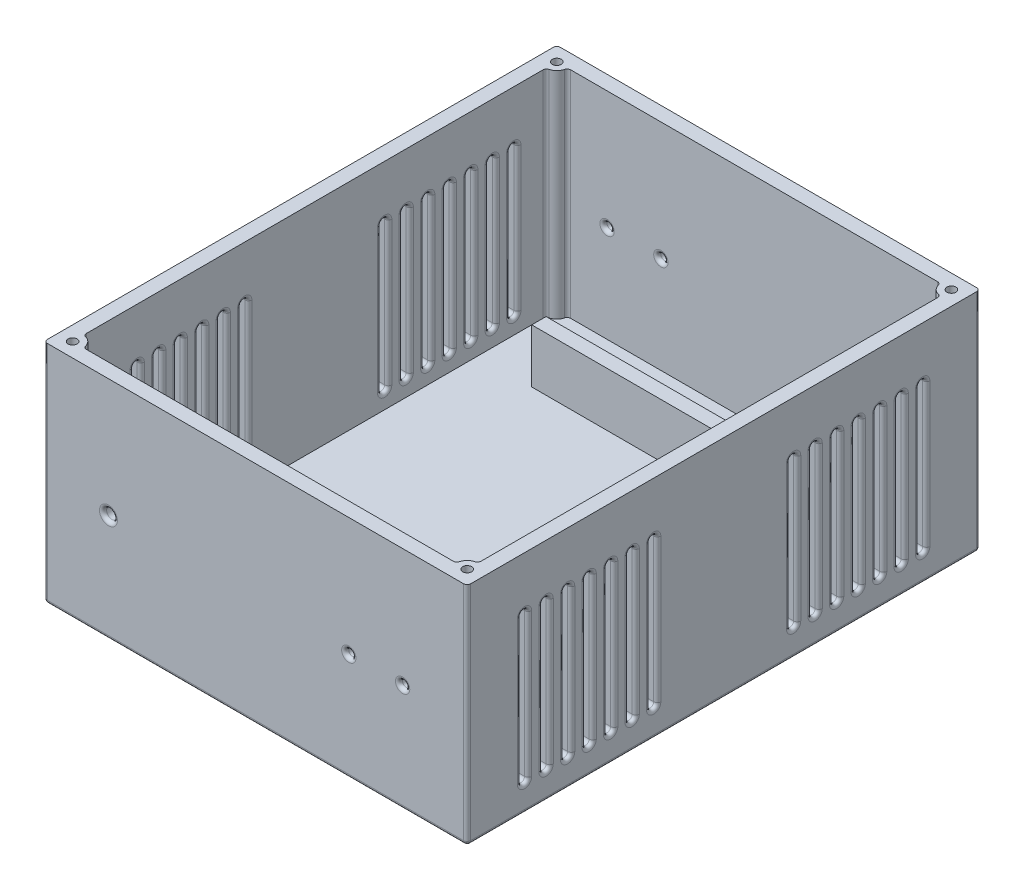
from build123d import *

# Parameters (mm, degrees)
SKETCH20_W           = 110
SKETCH20_H           = 135
BOSS_EXTRUDE7_DEPTH  = 3
SKETCH20_4_W         = 118
SKETCH20_4_H         = 143
SKETCH20_4_W_2       = 110
SKETCH20_4_H_2       = 135
BOSS_EXTRUDE8_DEPTH  = 63
BOSS_EXTRUDE9_DEPTH  = 60
SKETCH22_R           = 1.25
CUT_EXTRUDE9_DEPTH   = 40
FILLET1_R            = 1
SKETCH27_R           = 1
CUT_EXTRUDE7_DEPTH   = 4
CUT_EXTRUDE8_START   = -4
SKETCH28_R           = 1.5
SKETCH28_R_2         = 1
CUT_EXTRUDE8_DEPTH   = 4
SKETCH29_W           = 80
SKETCH29_H           = 4
BOSS_EXTRUDE11_DEPTH = 15
FILLET3_R            = 1
CUT_EXTRUDE10_DEPTH  = 4
CUT_EXTRUDE11_START  = -4
CUT_EXTRUDE11_DEPTH  = 4
FILLET5_R            = 1


with BuildPart() as part:
    # Sketch20 → Boss-Extrude7 (new body)
    with BuildSketch(Plane(origin=(0, 0, 0), x_dir=(1, 0, 0), z_dir=(0, 1, 0))):
        Rectangle(SKETCH20_W, SKETCH20_H)
    extrude(amount=BOSS_EXTRUDE7_DEPTH)

    # Sketch20<4> → Boss-Extrude8 (add)
    with BuildSketch(Plane(origin=(0, 0, 0), x_dir=(1, 0, 0), z_dir=(0, 1, 0))):
        Rectangle(SKETCH20_4_W, SKETCH20_4_H)
        Rectangle(SKETCH20_4_W_2, SKETCH20_4_H_2, mode=Mode.SUBTRACT)
    extrude(amount=BOSS_EXTRUDE8_DEPTH)

    # Sketch21 → Boss-Extrude9 (add)
    with BuildSketch(Plane(origin=(0, 3, 0), x_dir=(1, 0, 0), z_dir=(0, 1, 0))):
        with BuildLine():
            Line((-55, -67.5), (-55, -64.5))
            ThreePointArc((-55, -64.5), (-52.878679656, -65.378679656), (-52, -67.5))
            Line((-52, -67.5), (-55, -67.5))
        make_face()
        with BuildLine():
            Line((-55, 67.5), (-52, 67.5))
            ThreePointArc((-52, 67.5), (-52.878679656, 65.378679656), (-55, 64.5))
            Line((-55, 64.5), (-55, 67.5))
        make_face()
        with BuildLine():
            Line((55, -67.5), (52, -67.5))
            ThreePointArc((52, -67.5), (52.878679656, -65.378679656), (55, -64.5))
            Line((55, -64.5), (55, -67.5))
        make_face()
        with BuildLine():
            Line((55, 67.5), (55, 64.5))
            ThreePointArc((55, 64.5), (52.878679656, 65.378679656), (52, 67.5))
            Line((52, 67.5), (55, 67.5))
        make_face()
    extrude(amount=BOSS_EXTRUDE9_DEPTH)

    # Sketch22 → Cut-Extrude9 (cut)
    with BuildSketch(Plane(origin=(0, 63, 0), x_dir=(1, 0, 0), z_dir=(0, 1, 0))):
        with Locations((-55, -67.5)):
            Circle(SKETCH22_R)
        with Locations((-55, 67.5)):
            Circle(SKETCH22_R)
        with Locations((55, 67.5)):
            Circle(SKETCH22_R)
        with Locations((55, -67.5)):
            Circle(SKETCH22_R)
    extrude(amount=-CUT_EXTRUDE9_DEPTH, mode=Mode.SUBTRACT)

    # Fillet1
    fillet1_edges = [part.edges().sort_by_distance(p)[0] for p in [
        (-52, 33, -67.5),
        (-55, 33, -64.5),
        (-55, 33, 64.5),
        (52, 33, 67.5),
        (55, 33, 64.5),
        (55, 33, -64.5),
        (52, 33, -67.5),
        (-52, 33, 67.5),
    ]]
    fillet(fillet1_edges, radius=FILLET1_R)

    # Sketch27 → Cut-Extrude7 (cut)
    with BuildSketch(Plane(origin=(0, 0, -71.5), x_dir=(-1, 0, 0), z_dir=(0, 0, -1))):
        with Locations((-41, 30)):
            Circle(SKETCH27_R)
        with Locations((-26, 30)):
            Circle(SKETCH27_R)
        with Locations((41, 30)):
            Circle(SKETCH27_R)
        with Locations((26, 30)):
            Circle(SKETCH27_R)
    extrude(amount=-CUT_EXTRUDE7_DEPTH, mode=Mode.SUBTRACT)

    # Sketch28 → Cut-Extrude8 (cut)
    with BuildSketch(Plane.XY.offset(71.5).offset(CUT_EXTRUDE8_START)):
        with Locations((-41, 30)):
            Circle(SKETCH28_R)
        with Locations((41, 30)):
            Circle(SKETCH28_R_2)
        with Locations((26, 30)):
            Circle(SKETCH28_R_2)
    extrude(amount=CUT_EXTRUDE8_DEPTH, mode=Mode.SUBTRACT)

    # Sketch29 → Boss-Extrude11 (add)
    with BuildSketch(Plane(origin=(0, 3, 0), x_dir=(1, 0, 0), z_dir=(0, 1, 0))):
        with Locations((0, 47.5)):
            Rectangle(SKETCH29_W, SKETCH29_H)
        with Locations((0, -47.5)):
            Rectangle(SKETCH29_W, SKETCH29_H)
    extrude(amount=BOSS_EXTRUDE11_DEPTH)

    # Fillet3
    fillet3_edges = [part.edges().sort_by_distance(p)[0] for p in [
        (25, 30, 71.5),
        (40, 30, 71.5),
        (-42.5, 30, 71.5),
        (25, 30, 67.5),
        (40, 30, 67.5),
        (-42.5, 30, 67.5),
        (-40, 30, -67.5),
        (-25, 30, -67.5),
        (42, 30, -67.5),
        (27, 30, -67.5),
        (27, 30, -71.5),
        (-40, 30, -71.5),
        (-25, 30, -71.5),
        (42, 30, -71.5),
    ]]
    fillet(fillet3_edges, radius=FILLET3_R)

    # Sketch31 → Cut-Extrude10 (cut)
    with BuildSketch(Plane(origin=(59, 0, 0), x_dir=(0, 0, -1), z_dir=(1, 0, 0))):
        with BuildLine():
            Line((-54.5, 48), (-54.5, 8))
            ThreePointArc((-54.5, 8), (-55.5, 7), (-56.5, 8))
            Line((-56.5, 8), (-56.5, 48))
            ThreePointArc((-56.5, 48), (-55.5, 49), (-54.5, 48))
        make_face()
        with BuildLine():
            Line((-48.5, 48), (-48.5, 8))
            ThreePointArc((-48.5, 8), (-49.5, 7), (-50.5, 8))
            Line((-50.5, 8), (-50.5, 48))
            ThreePointArc((-50.5, 48), (-49.5, 49), (-48.5, 48))
        make_face()
        with BuildLine():
            Line((-42.5, 48), (-42.5, 8))
            ThreePointArc((-42.5, 8), (-43.5, 7), (-44.5, 8))
            Line((-44.5, 8), (-44.5, 48))
            ThreePointArc((-44.5, 48), (-43.5, 49), (-42.5, 48))
        make_face()
        with BuildLine():
            Line((-36.5, 48), (-36.5, 8))
            ThreePointArc((-36.5, 8), (-37.5, 7), (-38.5, 8))
            Line((-38.5, 8), (-38.5, 48))
            ThreePointArc((-38.5, 48), (-37.5, 49), (-36.5, 48))
        make_face()
        with BuildLine():
            Line((-30.5, 48), (-30.5, 8))
            ThreePointArc((-30.5, 8), (-31.5, 7), (-32.5, 8))
            Line((-32.5, 8), (-32.5, 48))
            ThreePointArc((-32.5, 48), (-31.5, 49), (-30.5, 48))
        make_face()
        with BuildLine():
            Line((-24.5, 48), (-24.5, 8))
            ThreePointArc((-24.5, 8), (-25.5, 7), (-26.5, 8))
            Line((-26.5, 8), (-26.5, 48))
            ThreePointArc((-26.5, 48), (-25.5, 49), (-24.5, 48))
        make_face()
        with BuildLine():
            Line((-18.5, 48), (-18.5, 8))
            ThreePointArc((-18.5, 8), (-19.5, 7), (-20.5, 8))
            Line((-20.5, 8), (-20.5, 48))
            ThreePointArc((-20.5, 48), (-19.5, 49), (-18.5, 48))
        make_face()
        with BuildLine():
            Line((18.5, 48), (18.5, 8))
            ThreePointArc((18.5, 8), (19.5, 7), (20.5, 8))
            Line((20.5, 8), (20.5, 48))
            ThreePointArc((20.5, 48), (19.5, 49), (18.5, 48))
        make_face()
        with BuildLine():
            Line((24.5, 48), (24.5, 8))
            ThreePointArc((24.5, 8), (25.5, 7), (26.5, 8))
            Line((26.5, 8), (26.5, 48))
            ThreePointArc((26.5, 48), (25.5, 49), (24.5, 48))
        make_face()
        with BuildLine():
            Line((30.5, 48), (30.5, 8))
            ThreePointArc((30.5, 8), (31.5, 7), (32.5, 8))
            Line((32.5, 8), (32.5, 48))
            ThreePointArc((32.5, 48), (31.5, 49), (30.5, 48))
        make_face()
        with BuildLine():
            Line((36.5, 48), (36.5, 8))
            ThreePointArc((36.5, 8), (37.5, 7), (38.5, 8))
            Line((38.5, 8), (38.5, 48))
            ThreePointArc((38.5, 48), (37.5, 49), (36.5, 48))
        make_face()
        with BuildLine():
            Line((42.5, 48), (42.5, 8))
            ThreePointArc((42.5, 8), (43.5, 7), (44.5, 8))
            Line((44.5, 8), (44.5, 48))
            ThreePointArc((44.5, 48), (43.5, 49), (42.5, 48))
        make_face()
        with BuildLine():
            Line((48.5, 48), (48.5, 8))
            ThreePointArc((48.5, 8), (49.5, 7), (50.5, 8))
            Line((50.5, 8), (50.5, 48))
            ThreePointArc((50.5, 48), (49.5, 49), (48.5, 48))
        make_face()
        with BuildLine():
            Line((54.5, 48), (54.5, 8))
            ThreePointArc((54.5, 8), (55.5, 7), (56.5, 8))
            Line((56.5, 8), (56.5, 48))
            ThreePointArc((56.5, 48), (55.5, 49), (54.5, 48))
        make_face()
    extrude(amount=-CUT_EXTRUDE10_DEPTH, mode=Mode.SUBTRACT)

    # Sketch32 → Cut-Extrude11 (cut)
    with BuildSketch(Plane.ZY.offset(59).offset(CUT_EXTRUDE11_START)):
        with BuildLine():
            Line((-54.5, 48), (-54.5, 8))
            ThreePointArc((-54.5, 8), (-55.5, 7), (-56.5, 8))
            Line((-56.5, 8), (-56.5, 48))
            ThreePointArc((-56.5, 48), (-55.5, 49), (-54.5, 48))
        make_face()
        with BuildLine():
            Line((-48.5, 48), (-48.5, 8))
            ThreePointArc((-48.5, 8), (-49.5, 7), (-50.5, 8))
            Line((-50.5, 8), (-50.5, 48))
            ThreePointArc((-50.5, 48), (-49.5, 49), (-48.5, 48))
        make_face()
        with BuildLine():
            Line((-42.5, 48), (-42.5, 8))
            ThreePointArc((-42.5, 8), (-43.5, 7), (-44.5, 8))
            Line((-44.5, 8), (-44.5, 48))
            ThreePointArc((-44.5, 48), (-43.5, 49), (-42.5, 48))
        make_face()
        with BuildLine():
            Line((-36.5, 48), (-36.5, 8))
            ThreePointArc((-36.5, 8), (-37.5, 7), (-38.5, 8))
            Line((-38.5, 8), (-38.5, 48))
            ThreePointArc((-38.5, 48), (-37.5, 49), (-36.5, 48))
        make_face()
        with BuildLine():
            Line((-30.5, 48), (-30.5, 8))
            ThreePointArc((-30.5, 8), (-31.5, 7), (-32.5, 8))
            Line((-32.5, 8), (-32.5, 48))
            ThreePointArc((-32.5, 48), (-31.5, 49), (-30.5, 48))
        make_face()
        with BuildLine():
            Line((-24.5, 48), (-24.5, 8))
            ThreePointArc((-24.5, 8), (-25.5, 7), (-26.5, 8))
            Line((-26.5, 8), (-26.5, 48))
            ThreePointArc((-26.5, 48), (-25.5, 49), (-24.5, 48))
        make_face()
        with BuildLine():
            Line((-18.5, 48), (-18.5, 8))
            ThreePointArc((-18.5, 8), (-19.5, 7), (-20.5, 8))
            Line((-20.5, 8), (-20.5, 48))
            ThreePointArc((-20.5, 48), (-19.5, 49), (-18.5, 48))
        make_face()
        with BuildLine():
            Line((18.5, 48), (18.5, 8))
            ThreePointArc((18.5, 8), (19.5, 7), (20.5, 8))
            Line((20.5, 8), (20.5, 48))
            ThreePointArc((20.5, 48), (19.5, 49), (18.5, 48))
        make_face()
        with BuildLine():
            Line((24.5, 48), (24.5, 8))
            ThreePointArc((24.5, 8), (25.5, 7), (26.5, 8))
            Line((26.5, 8), (26.5, 48))
            ThreePointArc((26.5, 48), (25.5, 49), (24.5, 48))
        make_face()
        with BuildLine():
            Line((30.5, 48), (30.5, 8))
            ThreePointArc((30.5, 8), (31.5, 7), (32.5, 8))
            Line((32.5, 8), (32.5, 48))
            ThreePointArc((32.5, 48), (31.5, 49), (30.5, 48))
        make_face()
        with BuildLine():
            Line((36.5, 48), (36.5, 8))
            ThreePointArc((36.5, 8), (37.5, 7), (38.5, 8))
            Line((38.5, 8), (38.5, 48))
            ThreePointArc((38.5, 48), (37.5, 49), (36.5, 48))
        make_face()
        with BuildLine():
            Line((42.5, 48), (42.5, 8))
            ThreePointArc((42.5, 8), (43.5, 7), (44.5, 8))
            Line((44.5, 8), (44.5, 48))
            ThreePointArc((44.5, 48), (43.5, 49), (42.5, 48))
        make_face()
        with BuildLine():
            Line((48.5, 48), (48.5, 8))
            ThreePointArc((48.5, 8), (49.5, 7), (50.5, 8))
            Line((50.5, 8), (50.5, 48))
            ThreePointArc((50.5, 48), (49.5, 49), (48.5, 48))
        make_face()
        with BuildLine():
            Line((54.5, 48), (54.5, 8))
            ThreePointArc((54.5, 8), (55.5, 7), (56.5, 8))
            Line((56.5, 8), (56.5, 48))
            ThreePointArc((56.5, 48), (55.5, 49), (54.5, 48))
        make_face()
    extrude(amount=CUT_EXTRUDE11_DEPTH, mode=Mode.SUBTRACT)

    # Fillet5
    fillet5_edges = [part.edges().sort_by_distance(p)[0] for p in [
        (-59, 0, 0),
        (-59, 31.5, -71.5),
        (0, 0, -71.5),
        (59, 31.5, -71.5),
        (59, 0, 0),
        (59, 31.5, 71.5),
        (-59, 31.5, 71.5),
        (0, 0, 71.5),
        (-55, 28, 56.5),
        (-55, 7, 55.5),
        (-55, 28, 54.5),
        (-55, 49, 55.5),
        (-55, 28, 50.5),
        (-55, 7, 49.5),
        (-55, 28, 48.5),
        (-55, 49, 49.5),
        (-55, 28, 44.5),
        (-55, 7, 43.5),
        (-55, 28, 42.5),
        (-55, 49, 43.5),
        (-55, 28, 38.5),
        (-55, 7, 37.5),
        (-55, 28, 36.5),
        (-55, 49, 37.5),
        (-55, 28, 32.5),
        (-55, 7, 31.5),
        (-55, 28, 30.5),
        (-55, 49, 31.5),
        (-55, 28, 26.5),
        (-55, 7, 25.5),
        (-55, 28, 24.5),
        (-55, 49, 25.5),
        (-55, 28, 20.5),
        (-55, 7, 19.5),
        (-55, 49, 19.5),
        (-55, 28, -18.5),
        (-55, 7, -19.5),
        (-55, 28, -20.5),
        (-55, 49, -19.5),
        (-55, 28, -24.5),
        (-55, 7, -25.5),
        (-55, 28, -26.5),
        (-55, 49, -25.5),
        (-55, 28, -30.5),
        (-55, 7, -31.5),
        (-55, 28, -32.5),
        (-55, 49, -31.5),
        (-55, 28, -36.5),
        (-55, 7, -37.5),
        (-55, 28, -38.5),
        (-55, 49, -37.5),
        (-55, 28, -42.5),
        (-55, 7, -43.5),
        (-55, 28, -44.5),
        (-55, 49, -43.5),
        (-55, 28, -48.5),
        (-55, 7, -49.5),
        (-55, 28, -50.5),
        (-55, 49, -49.5),
        (-55, 28, -54.5),
        (-55, 7, -55.5),
        (-55, 28, -56.5),
        (-55, 49, -55.5),
        (-55, 28, 18.5),
        (-59, 7, 55.5),
        (-59, 28, 56.5),
        (-59, 49, 55.5),
        (-59, 28, 54.5),
        (-59, 7, 49.5),
        (-59, 28, 50.5),
        (-59, 49, 49.5),
        (-59, 28, 48.5),
        (-59, 7, 43.5),
        (-59, 28, 44.5),
        (-59, 49, 43.5),
        (-59, 28, 42.5),
        (-59, 7, 37.5),
        (-59, 28, 38.5),
        (-59, 49, 37.5),
        (-59, 28, 36.5),
        (-59, 7, 31.5),
        (-59, 28, 32.5),
        (-59, 49, 31.5),
        (-59, 28, 30.5),
        (-59, 7, 25.5),
        (-59, 28, 26.5),
        (-59, 49, 25.5),
        (-59, 28, 24.5),
        (-59, 7, 19.5),
        (-59, 28, 20.5),
        (-59, 49, 19.5),
        (-59, 7, -19.5),
        (-59, 28, -18.5),
        (-59, 49, -19.5),
        (-59, 28, -20.5),
        (-59, 7, -25.5),
        (-59, 28, -24.5),
        (-59, 49, -25.5),
        (-59, 28, -26.5),
        (-59, 7, -31.5),
        (-59, 28, -30.5),
        (-59, 49, -31.5),
        (-59, 28, -32.5),
        (-59, 7, -37.5),
        (-59, 28, -36.5),
        (-59, 49, -37.5),
        (-59, 28, -38.5),
        (-59, 7, -43.5),
        (-59, 28, -42.5),
        (-59, 49, -43.5),
        (-59, 28, -44.5),
        (-59, 7, -49.5),
        (-59, 28, -48.5),
        (-59, 49, -49.5),
        (-59, 28, -50.5),
        (-59, 7, -55.5),
        (-59, 28, -54.5),
        (-59, 49, -55.5),
        (-59, 28, -56.5),
        (-59, 28, 18.5),
        (55, 7, -55.5),
        (55, 28, -54.5),
        (55, 49, -55.5),
        (55, 28, -56.5),
        (55, 7, -49.5),
        (55, 28, -48.5),
        (55, 49, -49.5),
        (55, 28, -50.5),
        (55, 7, -43.5),
        (55, 28, -42.5),
        (55, 49, -43.5),
        (55, 28, -44.5),
        (55, 7, -37.5),
        (55, 28, -36.5),
        (55, 49, -37.5),
        (55, 28, -38.5),
        (55, 7, -31.5),
        (55, 28, -30.5),
        (55, 49, -31.5),
        (55, 28, -32.5),
        (55, 7, -25.5),
        (55, 28, -24.5),
        (55, 49, -25.5),
        (55, 28, -26.5),
        (55, 7, -19.5),
        (55, 28, -18.5),
        (55, 49, -19.5),
        (55, 28, -20.5),
        (55, 7, 19.5),
        (55, 28, 20.5),
        (55, 49, 19.5),
        (55, 7, 25.5),
        (55, 28, 26.5),
        (55, 49, 25.5),
        (55, 28, 24.5),
        (55, 7, 31.5),
        (55, 28, 32.5),
        (55, 49, 31.5),
        (55, 28, 30.5),
        (55, 7, 37.5),
        (55, 28, 38.5),
        (55, 49, 37.5),
        (55, 28, 36.5),
        (55, 7, 43.5),
        (55, 28, 44.5),
        (55, 49, 43.5),
        (55, 28, 42.5),
        (55, 7, 49.5),
        (55, 28, 50.5),
        (55, 49, 49.5),
        (55, 28, 48.5),
        (55, 7, 55.5),
        (55, 28, 56.5),
        (55, 49, 55.5),
        (55, 28, 54.5),
        (55, 28, 18.5),
        (59, 28, -54.5),
        (59, 7, -55.5),
        (59, 28, -56.5),
        (59, 49, -55.5),
        (59, 28, -48.5),
        (59, 7, -49.5),
        (59, 28, -50.5),
        (59, 49, -49.5),
        (59, 28, -42.5),
        (59, 7, -43.5),
        (59, 28, -44.5),
        (59, 49, -43.5),
        (59, 28, -36.5),
        (59, 7, -37.5),
        (59, 28, -38.5),
        (59, 49, -37.5),
        (59, 28, -30.5),
        (59, 7, -31.5),
        (59, 28, -32.5),
        (59, 49, -31.5),
        (59, 28, -24.5),
        (59, 7, -25.5),
        (59, 28, -26.5),
        (59, 49, -25.5),
        (59, 28, -18.5),
        (59, 7, -19.5),
        (59, 28, -20.5),
        (59, 49, -19.5),
        (59, 28, 20.5),
        (59, 7, 19.5),
        (59, 28, 18.5),
        (59, 49, 19.5),
        (59, 28, 26.5),
        (59, 7, 25.5),
        (59, 28, 24.5),
        (59, 49, 25.5),
        (59, 28, 32.5),
        (59, 7, 31.5),
        (59, 28, 30.5),
        (59, 49, 31.5),
        (59, 28, 38.5),
        (59, 7, 37.5),
        (59, 28, 36.5),
        (59, 49, 37.5),
        (59, 28, 44.5),
        (59, 7, 43.5),
        (59, 28, 42.5),
        (59, 49, 43.5),
        (59, 28, 50.5),
        (59, 7, 49.5),
        (59, 28, 48.5),
        (59, 49, 49.5),
        (59, 7, 55.5),
        (59, 28, 54.5),
        (59, 49, 55.5),
        (59, 28, 56.5),
    ]]
    fillet(fillet5_edges, radius=FILLET5_R)


solid = part.part
